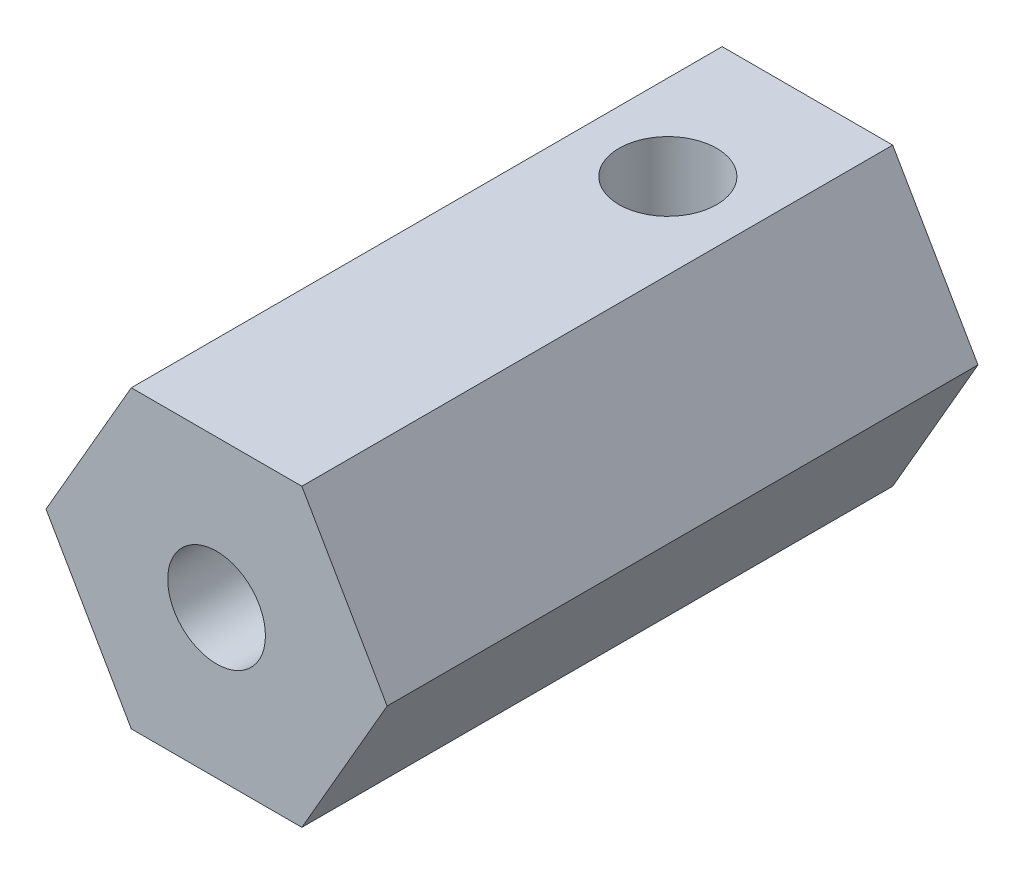
from build123d import *

# Parameters (mm, degrees)
BOSS_EXTRUDE1_DEPTH              = 25.4
SKETCH2_R                        = 3
CUT_EXTRUDE1_DEPTH               = 12.7
TAP_DRILL_FOR_M5X0_8_TAP1_D      = 4.2
TAP_DRILL_FOR_M5X0_8_TAP2_REACH  = 26.319
TAP_DRILL_FOR_M5X0_8_TAP2_BORE_R = 2.1


with BuildPart() as part:
    # Sketch1 → Boss-Extrude1 (new body)
    with BuildSketch(Plane.XY):
        Polygon((7.332348419, 0), (3.666174209, 6.35), (-3.666174209, 6.35), (-7.332348419, 0), (-3.666174209, -6.35), (3.666174209, -6.35), align=None)
    extrude(amount=BOSS_EXTRUDE1_DEPTH)

    # Sketch2 → Cut-Extrude1 (cut)
    with BuildSketch(Plane(origin=(0, 0, 0), x_dir=(-1, 0, 0), z_dir=(0, 0, -1))):
        Circle(SKETCH2_R)
    extrude(amount=-CUT_EXTRUDE1_DEPTH, mode=Mode.SUBTRACT)

    # Tap Drill for M5x0.8 Tap1 (through all)
    with Locations(Plane.XY.offset(25.4)):
        with Locations((0, 0)):
            Hole(TAP_DRILL_FOR_M5X0_8_TAP1_D / 2)

    # Tap Drill for M5x0.8 Tap2 bore (on position points) → Tap Drill for M5x0.8 Tap2 (cut, up to next)
    with BuildSketch(Plane(origin=(0, 6.35, 6), x_dir=(1, 0, 0), z_dir=(0, 1, 0)), mode=Mode.PRIVATE) as tap_drill_for_m5x0_8_tap2_sk1:
        Circle(TAP_DRILL_FOR_M5X0_8_TAP2_BORE_R)
    tap_drill_for_m5x0_8_tap2_tool1 = extrude(tap_drill_for_m5x0_8_tap2_sk1.sketch, amount=-TAP_DRILL_FOR_M5X0_8_TAP2_REACH, mode=Mode.PRIVATE) & part.part
    add(tap_drill_for_m5x0_8_tap2_tool1.solids().sort_by_distance((0, 6.35, 6))[0], mode=Mode.SUBTRACT)


solid = part.part
